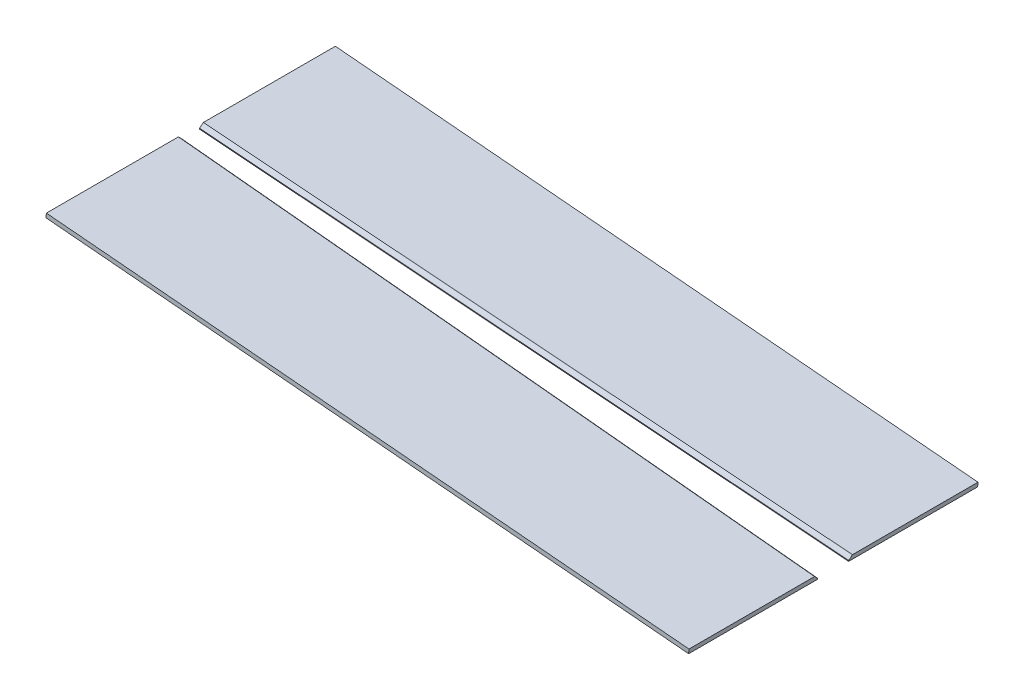
from build123d import *

# Parameters (mm, degrees)
BOSS_EXTRUDE1_DEPTH   = 5
BOSS_EXTRUDE1_2_DEPTH = 5
CHAMFER1_SIZE         = 4
CHAMFER2_SIZE         = 4


with BuildPart() as part:
    # Sketch2 → Boss-Extrude1 (new body)
    with BuildSketch(Plane(origin=(0, 0, 0), x_dir=(0, 0, 1), z_dir=(-0.08715574274765155, -0.9961946980917461, 0))):
        Polygon((-12, 600), (-18, 0), (-168, 0), (-168, 600), (-168, 750), (-10.5, 750), align=None)
    extrude(amount=-BOSS_EXTRUDE1_DEPTH)

    # Chamfer1
    chamfer1_edges = [part.edges().sort_by_distance(p)[0] for p in [
        (-373.137233071, 37.664377021, -14.25),
    ]]
    chamfer(chamfer1_edges, length=CHAMFER1_SIZE)


with BuildPart() as body_2:
    # Sketch2 → Boss-Extrude1 2 (new body)
    with BuildSketch(Plane(origin=(0, 0, 0), x_dir=(0, 0, 1), z_dir=(-0.08715574274765155, -0.9961946980917461, 0))):
        Polygon((12, 600), (18, 0), (168, 0), (168, 600), (168, 750), (10.5, 750), align=None)
    extrude(amount=-BOSS_EXTRUDE1_2_DEPTH)

    # Chamfer2
    chamfer2_edges = [body_2.edges().sort_by_distance(p)[0] for p in [
        (-373.137233071, 37.664377021, 14.25),
    ]]
    chamfer(chamfer2_edges, length=CHAMFER2_SIZE)


solid = Compound([part.part, body_2.part])
